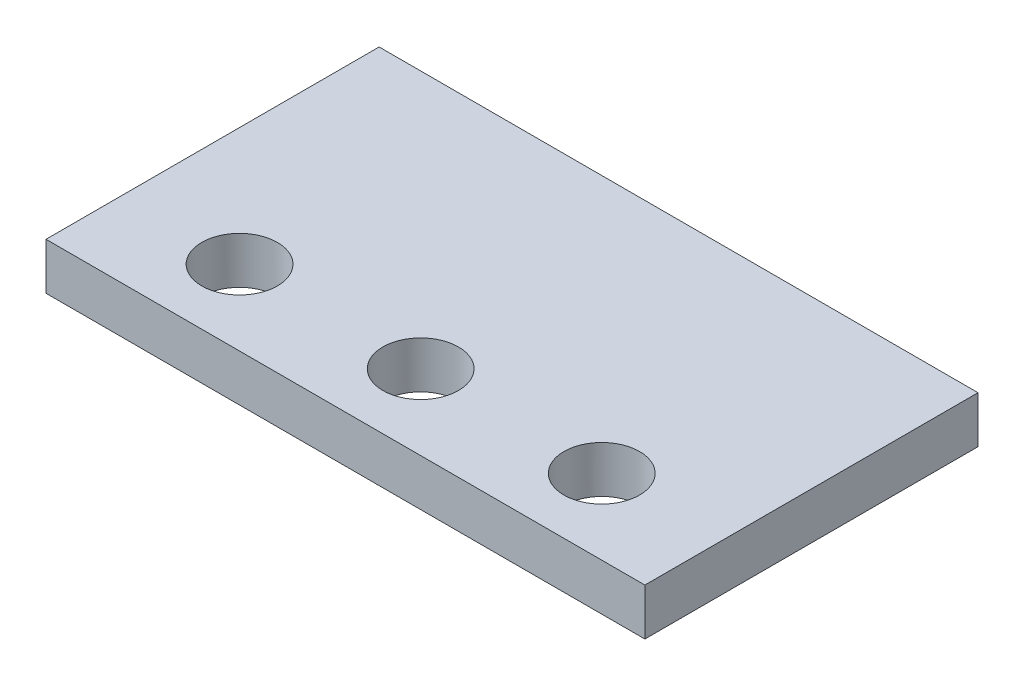
from build123d import *

# Parameters (mm, degrees)
CROQUIS1_W              = 160
CROQUIS1_H              = 25
SALIENTE_EXTRUIR1_DEPTH = 178
CORTAR_EXTRUIR1_REACH   = 399.953
CROQUIS2_R              = 20.190307202


with BuildPart() as part:
    # Croquis1 → Saliente-Extruir1 (new body)
    with BuildSketch(Plane(origin=(0, 0, 360), x_dir=(-1, 0, 0), z_dir=(0, 0, -1))):
        with Locations((-72.245907017, -154.665586138)):
            Rectangle(CROQUIS1_W, CROQUIS1_H)
        with Locations((87.754092983, -154.665586138)):
            Rectangle(CROQUIS1_W, CROQUIS1_H)
    extrude(amount=SALIENTE_EXTRUIR1_DEPTH)

    # Croquis2 → Cortar-Extruir1 (cut, up to next)
    with BuildSketch(Plane.XZ.offset(167.165586138), mode=Mode.PRIVATE) as cortar_extruir1_sk1:
        with Locations((-104.519454625, 319.809692798)):
            Circle(CROQUIS2_R)
    cortar_extruir1_tool1 = extrude(cortar_extruir1_sk1.sketch, amount=-CORTAR_EXTRUIR1_REACH, mode=Mode.PRIVATE) & part.part
    # Croquis2 → Cortar-Extruir1 (cut, up to next)
    with BuildSketch(Plane.XZ.offset(167.165586138), mode=Mode.PRIVATE) as cortar_extruir1_sk2:
        with Locations((-7.754092983, 319.809692798)):
            Circle(CROQUIS2_R)
    cortar_extruir1_tool2 = extrude(cortar_extruir1_sk2.sketch, amount=-CORTAR_EXTRUIR1_REACH, mode=Mode.PRIVATE) & part.part
    # Croquis2 → Cortar-Extruir1 (cut, up to next)
    with BuildSketch(Plane.XZ.offset(167.165586138), mode=Mode.PRIVATE) as cortar_extruir1_sk3:
        with Locations((89.011268658, 319.809692798)):
            Circle(CROQUIS2_R)
    cortar_extruir1_tool3 = extrude(cortar_extruir1_sk3.sketch, amount=-CORTAR_EXTRUIR1_REACH, mode=Mode.PRIVATE) & part.part
    add(cortar_extruir1_tool1.solids().sort_by_distance((-104.519455, -167.165586, 319.809693))[0], mode=Mode.SUBTRACT)
    add(cortar_extruir1_tool2.solids().sort_by_distance((-7.754093, -167.165586, 319.809693))[0], mode=Mode.SUBTRACT)
    add(cortar_extruir1_tool3.solids().sort_by_distance((89.011269, -167.165586, 319.809693))[0], mode=Mode.SUBTRACT)


solid = part.part
